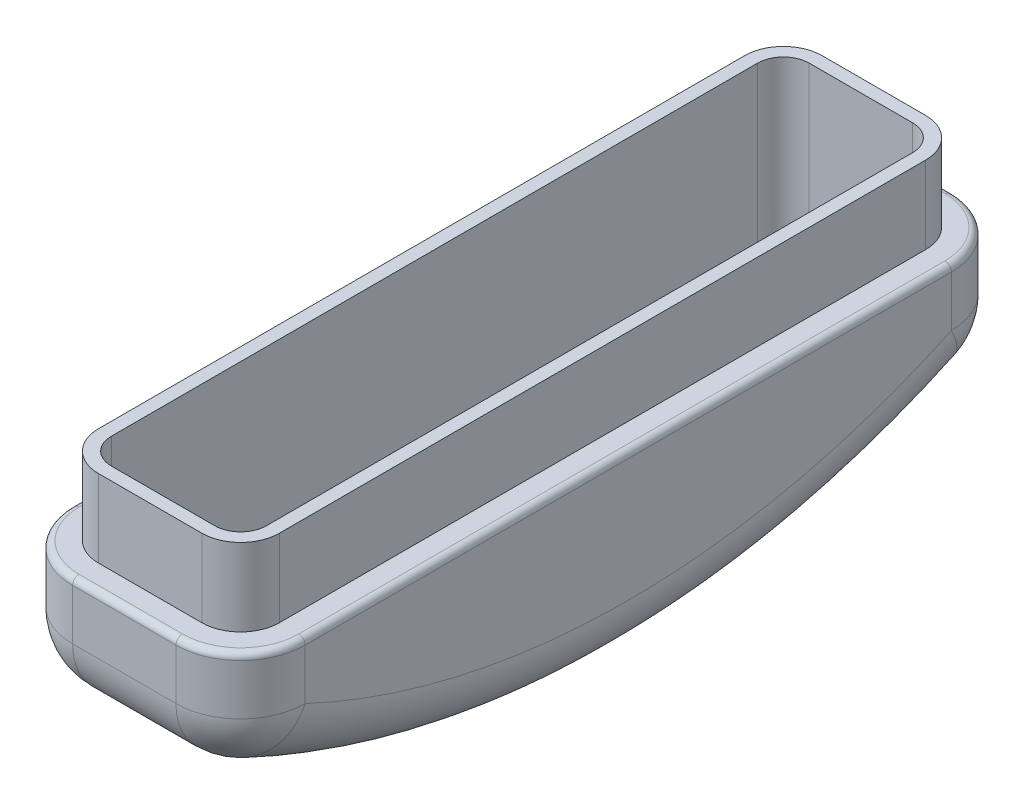
from build123d import *

# Parameters (mm, degrees)
BOSS_EXTRUDE1_DEPTH = 9
SHELL2_T            = -3
SKETCH3_W           = 14
SKETCH3_H           = 56
SKETCH3_W_2         = 12
SKETCH3_H_2         = 54
BOSS_EXTRUDE3_DEPTH = 6
FILLET1_R           = 5
FILLET5_R           = 5
FILLET8_R           = 0.5
FILLET9_R           = 3
FILLET10_R          = 2


with BuildPart() as part:
    # Sketch1 → Boss-Extrude1 (new, symmetric)
    with BuildSketch(Plane.YZ):
        with BuildLine():
            Line((0, 30), (-7.5, 30))
            ThreePointArc((-7.5, 30), (-15, 0), (-7.5, -30))
            Line((-7.5, -30), (0, -30))
            Line((0, -30), (0, 30))
        make_face()
    extrude(amount=BOSS_EXTRUDE1_DEPTH, both=True)

    # Shell2
    shell2_openings = [part.faces().sort_by_distance(p)[0] for p in [
        (0, 0, 0),
    ]]
    offset(amount=SHELL2_T, openings=shell2_openings, kind=Kind.INTERSECTION)

    # Sketch3 → Boss-Extrude3 (add, symmetric)
    with BuildSketch(Plane(origin=(0, 0, 0), x_dir=(-1, 0, 0), z_dir=(0, 1, 0))):
        Rectangle(SKETCH3_W, SKETCH3_H)
        Rectangle(SKETCH3_W_2, SKETCH3_H_2, mode=Mode.SUBTRACT)
    extrude(amount=BOSS_EXTRUDE3_DEPTH, both=True)

    # Fillet1
    fillet1_edges = [part.edges().sort_by_distance(p)[0] for p in [
        (0, -7.5, -30),
        (0, -7.5, 30),
    ]]
    fillet(fillet1_edges, radius=FILLET1_R)

    # Fillet5
    fillet5_edges = [part.edges().sort_by_distance(p)[0] for p in [
        (9, -2.207712898, 30),
        (-9, -2.207712898, -30),
        (9, -2.207712898, -30),
        (-9, -15, 0),
        (-9, -7.095136799, 29.221273379),
        (-9, -2.207712898, 30),
        (-9, -7.095136799, -29.221273379),
        (9, -15, 0),
        (9, -7.095136799, 29.221273379),
        (9, -7.095136799, -29.221273379),
    ]]
    fillet(fillet5_edges, radius=FILLET5_R)

    # Fillet8
    fillet8_edges = [part.edges().sort_by_distance(p)[0] for p in [
        (0, 0, 30),
        (-9, 0, 0),
        (9, 0, 0),
        (0, 0, -30),
        (7.535533906, 0, -28.535533906),
        (7.535533906, 0, 28.535533906),
        (-7.535533906, 0, -28.535533906),
        (-7.535533906, 0, 28.535533906),
    ]]
    fillet(fillet8_edges, radius=FILLET8_R)

    # Fillet9
    fillet9_edges = [part.edges().sort_by_distance(p)[0] for p in [
        (-7, 3, 28),
        (7, 3, 28),
        (7, 3, -28),
        (-7, 3, -28),
    ]]
    fillet(fillet9_edges, radius=FILLET9_R)

    # Fillet10
    fillet10_edges = [part.edges().sort_by_distance(p)[0] for p in [
        (-6, 0.164880099, 27),
        (-6, 0.164880099, -27),
        (6, 0.164880099, 27),
        (6, 0.164880099, -27),
    ]]
    fillet(fillet10_edges, radius=FILLET10_R)


solid = part.part
